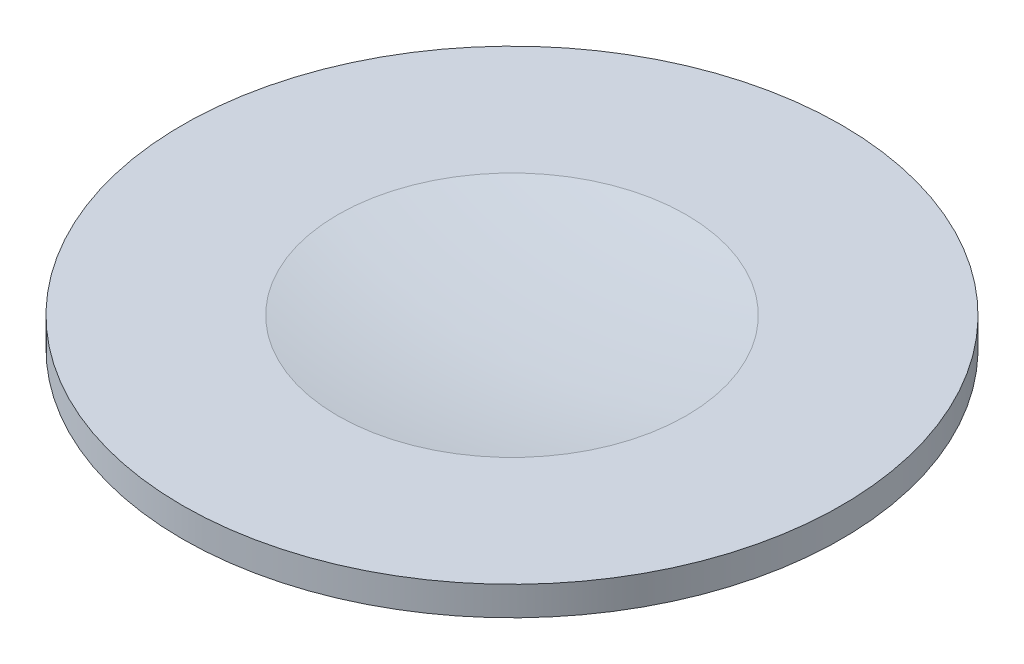
from build123d import *

# Parameters (mm, degrees)
SKETCH1_R           = 11.35
BOSS_EXTRUDE1_DEPTH = 1


with BuildPart() as part:
    # Sketch1 → Boss-Extrude1 (new body)
    with BuildSketch(Plane(origin=(0, 0, 0), x_dir=(1, 0, 0), z_dir=(0, 1, 0))):
        with Locations(Location((0, 0, 0), (0, 0, 270))):
            Circle(SKETCH1_R)
    extrude(amount=BOSS_EXTRUDE1_DEPTH)

    # Sketch2 → Cut-Revolve1 (revolve, cut)
    with BuildSketch(Plane.XY):
        with BuildLine():
            Line((0, 1), (6, 1))
            ThreePointArc((6, 1), (3.011164603, 0.611650052), (0, 0.481879299))
            Line((0, 0.481879299), (0, 1))
        make_face()
    revolve(axis=Axis((0, 3.505343026, 0), (0, -1, 0)), mode=Mode.SUBTRACT)


solid = part.part
